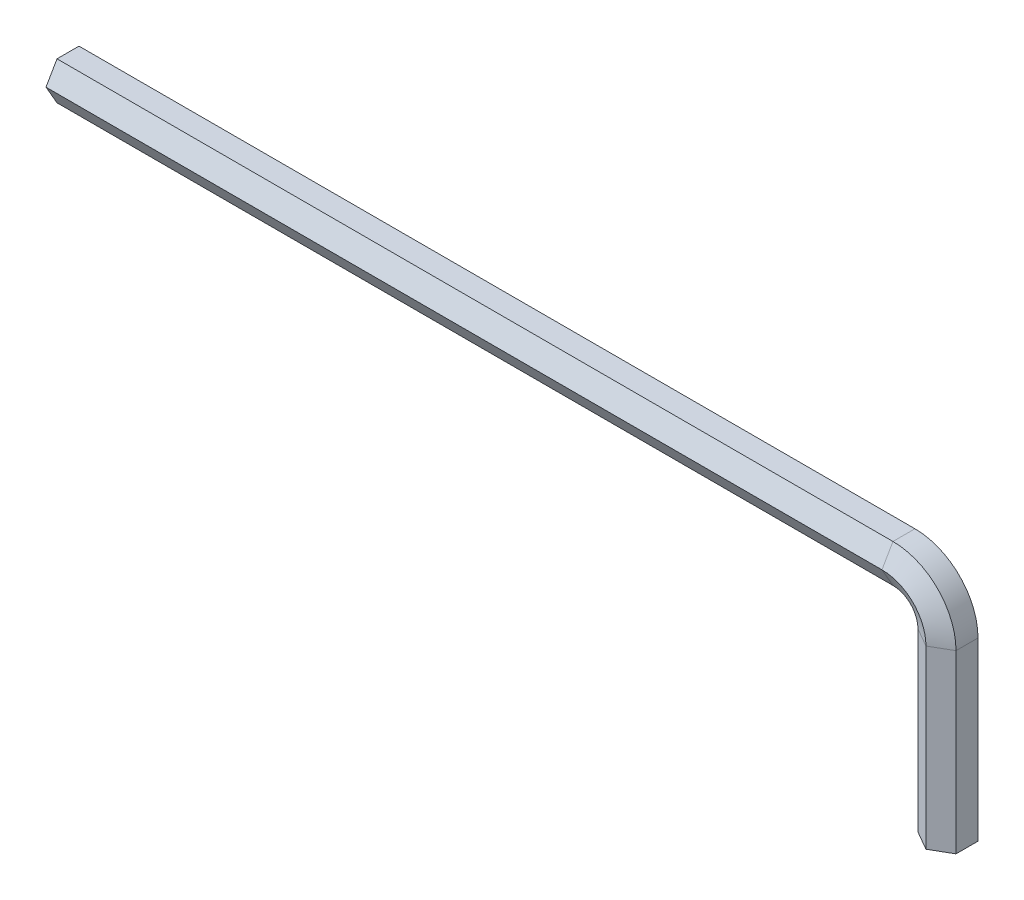
from build123d import *


with BuildPart() as part:
    # Sweep1: sweep along a path in Sketch1
    with BuildLine(Plane.XY) as sweep1_path:
        Line((0, 0), (190, 0))
        ThreePointArc((190, 0), (197.071067812, -2.928932188), (200, -10))
        Line((200, -10), (200, -50))
    # Sketch2 → Sweep1 (sweep)
    with BuildSketch(Plane(origin=(0, 0, 0), x_dir=(0, 0, -1), z_dir=(1, 0, 0))):
        Polygon((2.5, -4.330127019), (5, 0), (2.5, 4.330127019), (-2.5, 4.330127019), (-5, 0), (-2.5, -4.330127019), align=None)
    sweep(path=sweep1_path.line)


solid = part.part
